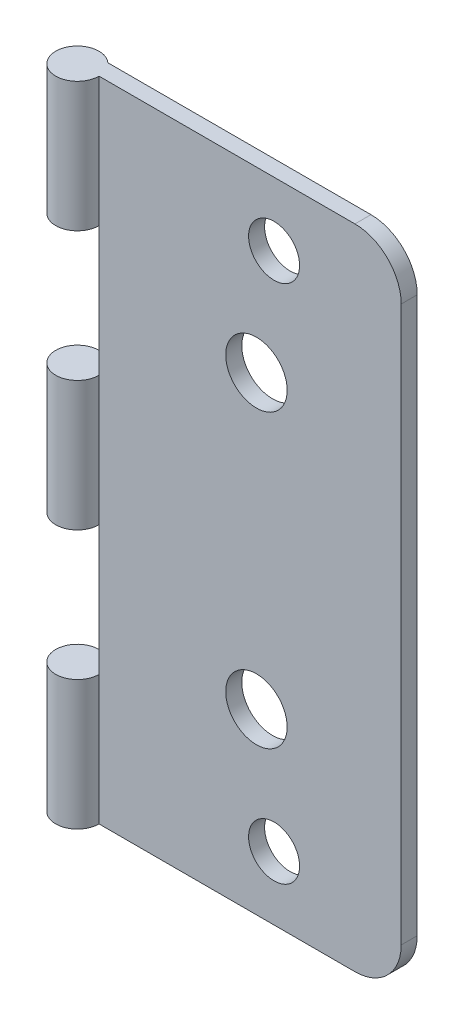
from build123d import *

# Parameters (mm, degrees)
SKETCH1_R                = 2.97
SKETCH1_W                = 44.45
SKETCH1_H                = 2.2
BOSS_EXTRUDE1_DEPTH      = 44.45
CUT_EXTRUDE1_DEPTH       = 63.931914797
CUT_EXTRUDE1_DEPTH_BACK  = 63.931914797
SKETCH2_W                = 5.94
SKETCH2_H                = 17.78
FILLET1_R                = 6.35
SKETCH4_R                = 3.5
CUT_EXTRUDE2_DEPTH       = 63.931914797
F_5_16_CLEARANCE_HOLE1_D = 8.4328


with BuildPart() as part:
    # Sketch1 → Boss-Extrude1 (new, symmetric)
    with BuildSketch(Plane(origin=(0, 0, 0), x_dir=(1, 0, 0), z_dir=(0, 1, 0))):
        Circle(SKETCH1_R)
        with Locations((22.225, 1.1)):
            Rectangle(SKETCH1_W, SKETCH1_H)
    extrude(amount=BOSS_EXTRUDE1_DEPTH, both=True)

    # Sketch2 → Cut-Extrude1 (cut, two sides: drawn at the far end of the back side and taken through both)
    with BuildSketch(Plane.XY.offset(-CUT_EXTRUDE1_DEPTH_BACK)):
        with Locations((0, 17.78)):
            Rectangle(SKETCH2_W, SKETCH2_H)
        with Locations((0, -17.78)):
            Rectangle(SKETCH2_W, SKETCH2_H)
    extrude(amount=CUT_EXTRUDE1_DEPTH + CUT_EXTRUDE1_DEPTH_BACK, mode=Mode.SUBTRACT)

    # Fillet1
    fillet1_edges = [part.edges().sort_by_distance(p)[0] for p in [
        (44.45, 44.45, -1.1),
        (44.45, -44.45, -1.1),
    ]]
    fillet(fillet1_edges, radius=FILLET1_R)

    # Sketch4 → Cut-Extrude2 (cut, through all)
    with BuildSketch(Plane.XY):
        with Locations((27, 35.7)):
            Circle(SKETCH4_R)
        with Locations((27, -35.7)):
            Circle(SKETCH4_R)
    extrude(amount=-CUT_EXTRUDE2_DEPTH, mode=Mode.SUBTRACT)

    # 5/16 Clearance Hole1 (through all)
    with Locations(Plane.XY):
        with Locations((24.58125, 20.010345019), (24.58125, -20.010345019)):
            Hole(F_5_16_CLEARANCE_HOLE1_D / 2)


solid = part.part
